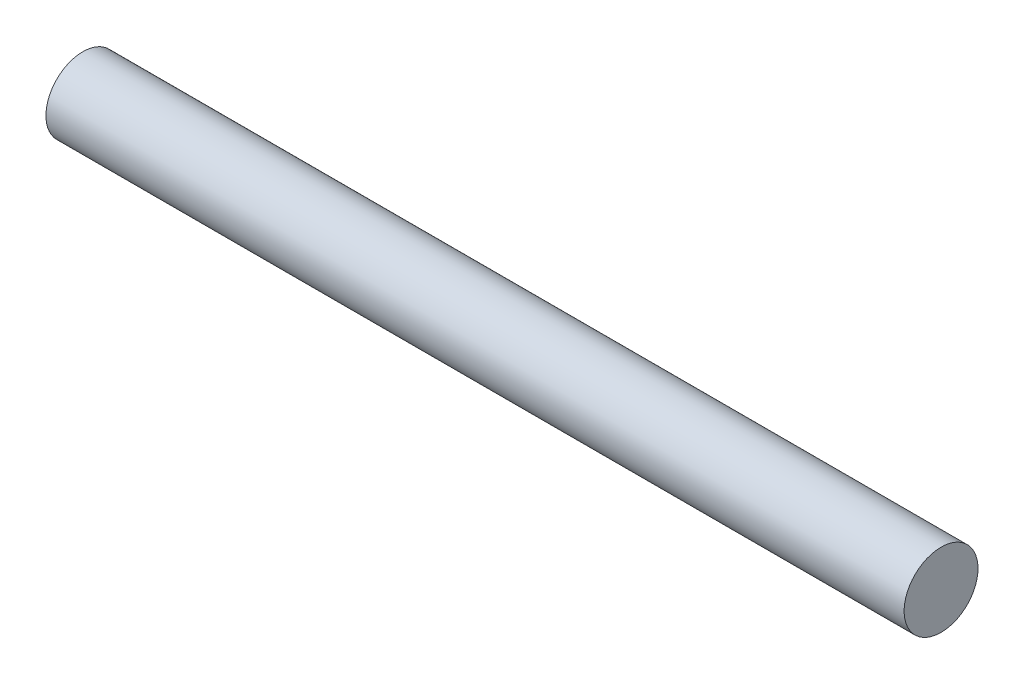
from build123d import *

# Parameters (mm, degrees)
SKETCH1_R           = 9.9
BOSS_EXTRUDE2_DEPTH = 230


with BuildPart() as part:
    # Sketch1 → Boss-Extrude2 (new body)
    with BuildSketch(Plane.YZ):
        with Locations(Location((0, 0, 0), (0, 0, 270))):
            Circle(SKETCH1_R)
    extrude(amount=BOSS_EXTRUDE2_DEPTH)


solid = part.part
